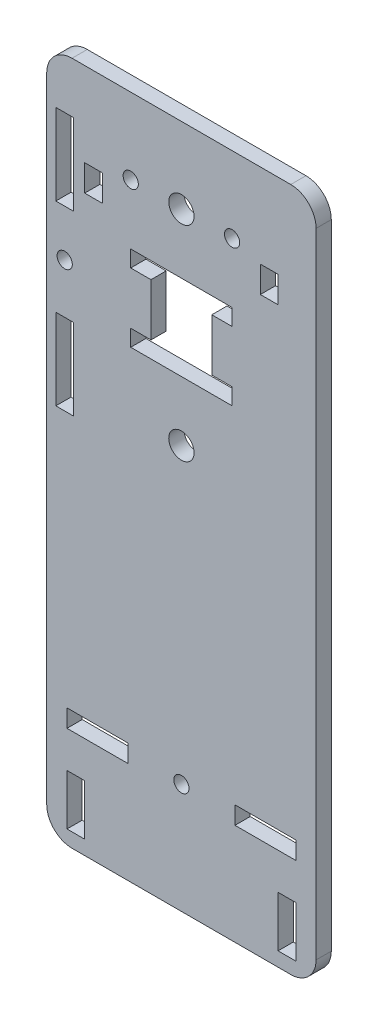
from build123d import *

# Parameters (mm, degrees)
CROQUIS1_R              = 1.5
CROQUIS1_R_2            = 2.5
CROQUIS1_W              = 12
CROQUIS1_H              = 3.5
CROQUIS1_W_2            = 3.5
CROQUIS1_H_2            = 10
CROQUIS1_H_3            = 16
CROQUIS1_H_4            = 5.2
SALIENTE_EXTRUIR1_DEPTH = 3


with BuildPart() as part:
    # Croquis1 → Saliente-Extruir1 (new body)
    with BuildSketch(Plane.XY):
        with BuildLine():
            Line((21.575, -67.5), (-21.575, -67.5))
            ThreePointArc((-21.575, -67.5), (-25.110533906, -66.035533906), (-26.575, -62.5))
            Line((-26.575, -62.5), (-26.575, 62.5))
            ThreePointArc((-26.575, 62.5), (-25.110533906, 66.035533906), (-21.575, 67.5))
            Line((-21.575, 67.5), (21.575, 67.5))
            ThreePointArc((21.575, 67.5), (25.110533906, 66.035533906), (26.575, 62.5))
            Line((26.575, 62.5), (26.575, -62.5))
            ThreePointArc((26.575, -62.5), (25.110533906, -66.035533906), (21.575, -67.5))
        make_face()
        with Locations((0, -45.75)):
            Circle(CROQUIS1_R, mode=Mode.SUBTRACT)
        with Locations((-23.025, 32.3)):
            Circle(CROQUIS1_R, mode=Mode.SUBTRACT)
        with Locations((0, 52.5)):
            Circle(CROQUIS1_R_2, mode=Mode.SUBTRACT)
        with Locations((-10, 52.5)):
            Circle(CROQUIS1_R, mode=Mode.SUBTRACT)
        with Locations(Location((10, 52.5, 0), (0, 0, 180))):
            Circle(CROQUIS1_R, mode=Mode.SUBTRACT)
        with Locations(Location((0, 12.1, 0), (0, 0, 180))):
            Circle(CROQUIS1_R_2, mode=Mode.SUBTRACT)
        with Locations((-16.575, -45.75)):
            Rectangle(CROQUIS1_W, CROQUIS1_H, mode=Mode.SUBTRACT)
        with Locations((20.825, -59.7)):
            Rectangle(CROQUIS1_W_2, CROQUIS1_H_2, mode=Mode.SUBTRACT)
        with Locations((16.575, -45.75)):
            Rectangle(CROQUIS1_W, CROQUIS1_H, mode=Mode.SUBTRACT)
        with Locations((-20.825, -59.7)):
            Rectangle(CROQUIS1_W_2, CROQUIS1_H_2, mode=Mode.SUBTRACT)
        Polygon((10, 23.9), (-10, 23.9), (-10, 27.15), (-6, 27.15), (-6, 37.45), (-10, 37.45), (-10, 40.7), (10, 40.7), (10, 37.45), (6, 37.45), (6, 27.15), (10, 27.15), align=None, mode=Mode.SUBTRACT)
        with Locations((-23.025, 49.5)):
            Rectangle(CROQUIS1_W_2, CROQUIS1_H_3, mode=Mode.SUBTRACT)
        with Locations((-23.025, 14.5)):
            Rectangle(CROQUIS1_W_2, CROQUIS1_H_3, mode=Mode.SUBTRACT)
        with Locations((17.325, 48.3)):
            Rectangle(CROQUIS1_W_2, CROQUIS1_H_4, mode=Mode.SUBTRACT)
        with Locations((-17.325, 48.3)):
            Rectangle(CROQUIS1_W_2, CROQUIS1_H_4, mode=Mode.SUBTRACT)
    extrude(amount=SALIENTE_EXTRUIR1_DEPTH)


solid = part.part
